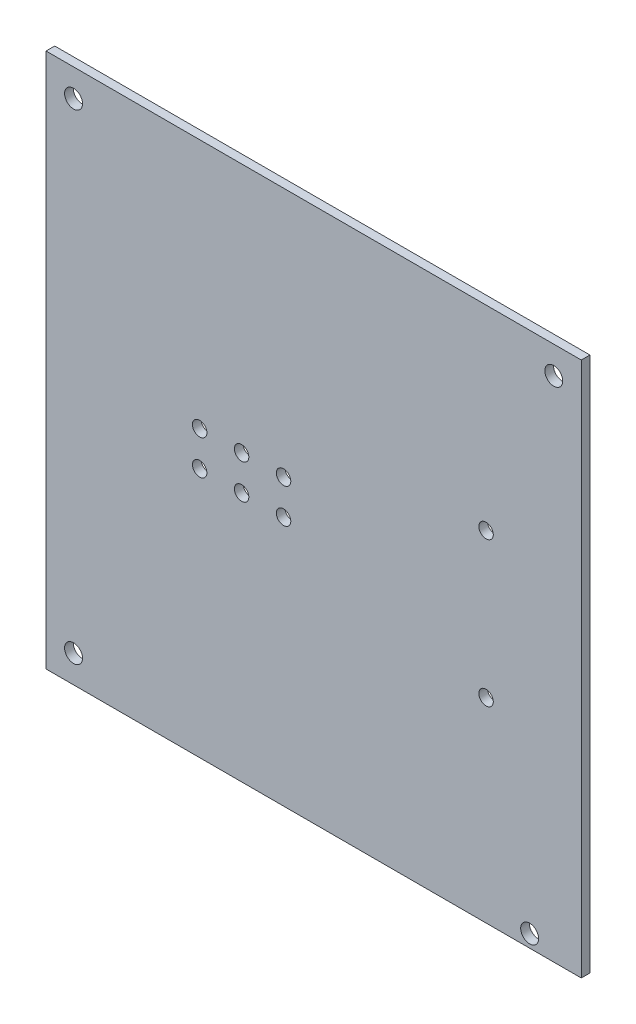
from build123d import *

# Parameters (mm, degrees)
SKETCH1_W                  = 92.5
SKETCH1_H                  = 92.5
BOSS_EXTRUDE1_DEPTH        = 1.5
F_3_1_3_1_DIAMETER_HOLE1_D = 3.1
F_2_5_2_5_DIAMETER_HOLE1_D = 2.5


with BuildPart() as part:
    # Sketch1 → Boss-Extrude1 (new body)
    with BuildSketch(Plane.XY):
        Rectangle(SKETCH1_W, SKETCH1_H)
    extrude(amount=BOSS_EXTRUDE1_DEPTH)

    # Ø3.1 (3.1) Diameter Hole1 (through all)
    with Locations(Plane.XY.offset(1.5)):
        with Locations((-41.5, 41.5), (41.5, 41.5), (37.33, -44.05), (-41.5, -41.5)):
            Hole(F_3_1_3_1_DIAMETER_HOLE1_D / 2)

    # Ø2.5 (2.5) Diameter Hole1 (through all)
    with Locations(Plane(origin=(0, 0, 0), x_dir=(-1, 0, 0), z_dir=(0, 0, -1))):
        with Locations((19.704975955, 3), (19.704975955, -3), (12.454975955, -3), (12.454975955, 3), (5.204975955, 3), (5.204975955, -3), (-29.795024045, 12.502014748), (-29.795024045, -12.501777911)):
            Hole(F_2_5_2_5_DIAMETER_HOLE1_D / 2)


solid = part.part
